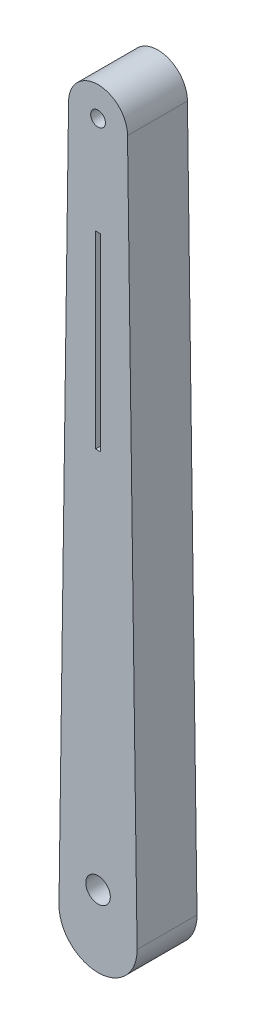
from build123d import *

# Parameters (mm, degrees)
SKETCH2_R                    = 1.5
SKETCH2_R_2                  = 2.5
BOSS_EXTRUDE1_DEPTH          = 12.2
CUT_EXTRUDE_THIN2_DEPTH      = 82.319370386
CUT_EXTRUDE_THIN2_DEPTH_BACK = 60
CUT_EXTRUDE_THIN3_DEPTH      = 82.314797438
CUT_EXTRUDE_THIN3_DEPTH_BACK = 10
SKETCH4_W                    = 1
SKETCH4_H                    = 38.438218158


with BuildPart() as part:
    # Sketch2 → Boss-Extrude1 (new body)
    with BuildSketch(Plane.XY):
        with BuildLine():
            Line((-8, -72), (-6, 74))
            ThreePointArc((-6, 74), (0, 80), (6, 74))
            Line((6, 74), (8, -72))
            ThreePointArc((8, -72), (0, -80), (-8, -72))
        make_face()
        with Locations((0, 74)):
            Circle(SKETCH2_R, mode=Mode.SUBTRACT)
        with Locations((0, -62)):
            Circle(SKETCH2_R_2, mode=Mode.SUBTRACT)
    extrude(amount=BOSS_EXTRUDE1_DEPTH)

    # Sketch3 → Cut-Extrude-Thin2 (cut, two sides: drawn at the far end of the back side and taken through both)
    with BuildSketch(Plane.XY.offset(12.2).offset(-CUT_EXTRUDE_THIN2_DEPTH_BACK)):
        with BuildLine():
            ThreePointArc((-7.952635689, -68.542405266), (0, -76.6047273), (7.952635689, -68.542405266))
            Line((7.952635689, -68.542405266), (17.951697558, -68.405431815))
            ThreePointArc((17.951697558, -68.405431815), (0, -86.6047273), (-17.951697558, -68.405431815))
            Line((-17.951697558, -68.405431815), (-7.952635689, -68.542405266))
        make_face()
    extrude(amount=CUT_EXTRUDE_THIN2_DEPTH + CUT_EXTRUDE_THIN2_DEPTH_BACK, mode=Mode.SUBTRACT)

    # Sketch4 → Cut-Extrude-Thin3 (cut, two sides: drawn at the far end of the back side and taken through both)
    with BuildSketch(Plane.XY.offset(12.2).offset(-CUT_EXTRUDE_THIN3_DEPTH_BACK)):
        with Locations((0, 34.719285659)):
            Rectangle(SKETCH4_W, SKETCH4_H)
    extrude(amount=CUT_EXTRUDE_THIN3_DEPTH + CUT_EXTRUDE_THIN3_DEPTH_BACK, mode=Mode.SUBTRACT)


solid = part.part
